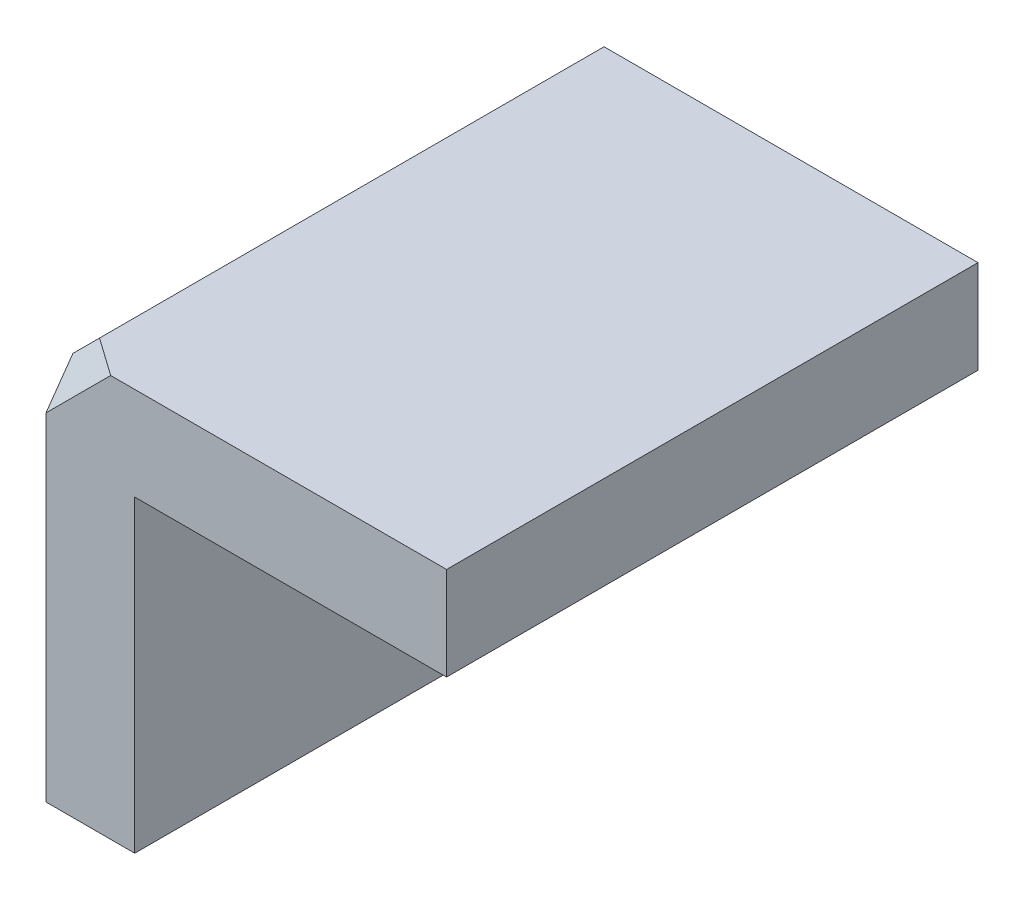
from build123d import *

# Parameters (mm, degrees)
BOSS_EXTRUDE1_DEPTH     = 50
CUT_EXTRUDE2_DEPTH      = 118.930495595
CUT_EXTRUDE2_DEPTH_BACK = 118.930495595


with BuildPart() as part:
    # Sketch2 → Boss-Extrude1 (new, symmetric)
    with BuildSketch(Plane.XY):
        Polygon((5.01375486, 0), (75.378877849, 0), (75.378877849, -17.541748785), (16.697188205, -17.541748785), (16.697188205, -75.591834267), (0, -75.591834267), (0, -5.01375486), align=None)
    extrude(amount=BOSS_EXTRUDE1_DEPTH, both=True)

    # Sketch6 → Cut-Extrude2 (cut, two sides: drawn at the far end of the back side and taken through both)
    with BuildSketch(Plane(origin=(-2.50687743, -2.50687743, 0), x_dir=(0, 0, 1), z_dir=(0.7071067811865464, 0.7071067811865488, 0)).offset(-CUT_EXTRUDE2_DEPTH_BACK)):
        Polygon((44.940550834, 3.545260061), (50.113588722, 8.718297949), (50.113590784, 3.494380863), align=None)
    extrude(amount=CUT_EXTRUDE2_DEPTH + CUT_EXTRUDE2_DEPTH_BACK, mode=Mode.SUBTRACT)


solid = part.part
